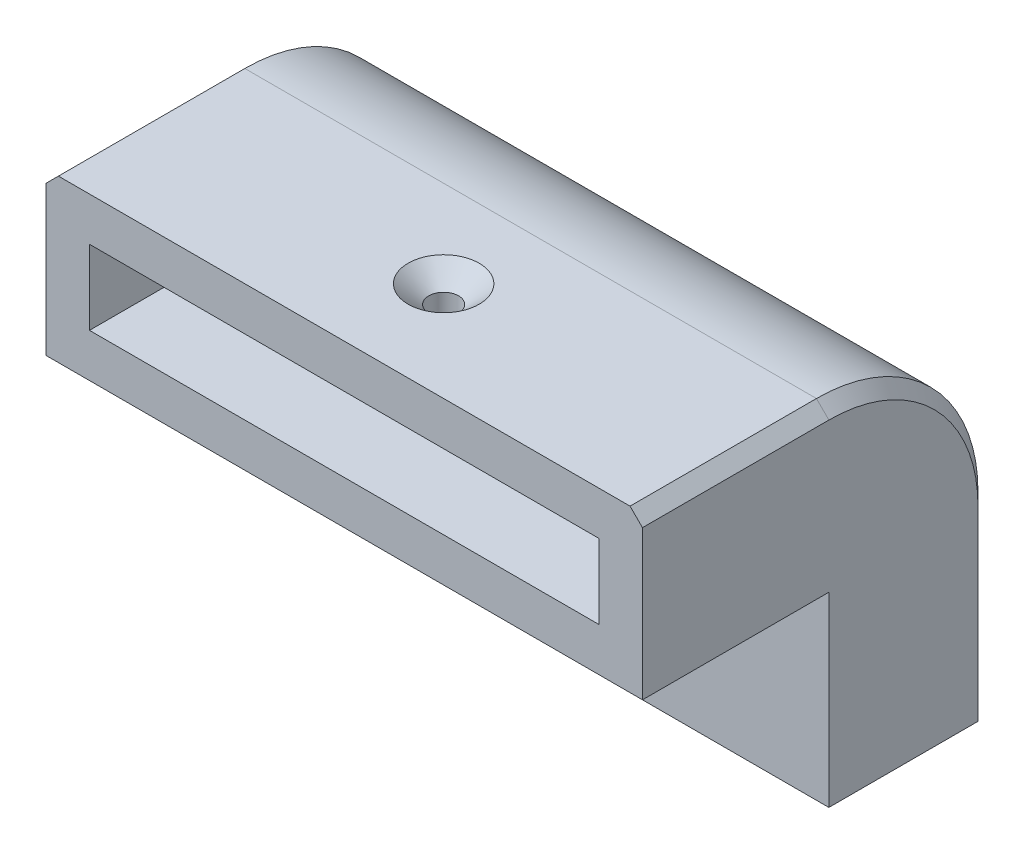
from build123d import *
from OCP.BRepFilletAPI import BRepFilletAPI_MakeChamfer

# Parameters (mm, degrees)
SKETCH1_W           = 60.96
SKETCH1_H           = 16.51
SKETCH1_W_2         = 50.8
SKETCH1_H_2         = 6.35
BOSS_EXTRUDE1_DEPTH = 19.05
BOSS_EXTRUDE2_DEPTH = 60.96
SKETCH6_W           = 50.8
SKETCH6_H           = 6.35
CUT_EXTRUDE1_DEPTH  = 19.05
SKETCH7_R           = 1.524
CUT_EXTRUDE2_DEPTH  = 59.805251466
SKETCH8_R           = 1.524
CUT_EXTRUDE3_DEPTH  = 55.213531752
CHAMFER1_SIZE       = 2.1082
CHAMFER1_SIZE2      = 1.832630301
SKETCH9_W           = 52.07
SKETCH9_H           = 7.62
CUT_EXTRUDE4_DEPTH  = 19.05
SKETCH10_W          = 52.07
SKETCH10_H          = 7.62
CUT_EXTRUDE5_DEPTH  = 19.05
CHAMFER2_SIZE       = 1.27


with BuildPart() as part:
    # Sketch1 → Boss-Extrude1 (new body)
    with BuildSketch(Plane(origin=(0, 0, 0), x_dir=(1, 0, 0), z_dir=(0, 1, 0))):
        Rectangle(SKETCH1_W, SKETCH1_H)
        Rectangle(SKETCH1_W_2, SKETCH1_H_2, mode=Mode.SUBTRACT)
    extrude(amount=BOSS_EXTRUDE1_DEPTH)

    # Sketch5 → Boss-Extrude2 (add)
    with BuildSketch(Plane(origin=(30.48, 0, 0), x_dir=(0, 0, -1), z_dir=(1, 0, 0))):
        with BuildLine():
            Line((-8.255, 35.56), (-27.305, 35.56))
            Line((-27.305, 35.56), (-27.305, 19.05))
            Line((-27.305, 19.05), (-8.255, 19.05))
            Line((-8.255, 19.05), (8.255, 19.05))
            ThreePointArc((8.255, 19.05), (3.419332957, 30.724332957), (-8.255, 35.56))
        make_face()
    extrude(amount=-BOSS_EXTRUDE2_DEPTH)

    # Sketch6 → Cut-Extrude1 (cut)
    with BuildSketch(Plane.XY.offset(27.305)):
        with Locations((0, 27.305)):
            Rectangle(SKETCH6_W, SKETCH6_H)
    extrude(amount=-CUT_EXTRUDE1_DEPTH, mode=Mode.SUBTRACT)

    # Sketch7 → Cut-Extrude2 (cut, through all)
    with BuildSketch(Plane(origin=(0, 0, -8.255), x_dir=(-1, 0, 0), z_dir=(0, 0, -1))):
        with Locations((0, 10.16)):
            Circle(SKETCH7_R)
    extrude(amount=-CUT_EXTRUDE2_DEPTH, mode=Mode.SUBTRACT)

    # Sketch8 → Cut-Extrude3 (cut, through all)
    with BuildSketch(Plane(origin=(0, 35.56, 0), x_dir=(1, 0, 0), z_dir=(0, 1, 0))):
        with Locations(Location((0, -17.145, 0), (0, 0, 270))):
            Circle(SKETCH8_R)
    extrude(amount=-CUT_EXTRUDE3_DEPTH, mode=Mode.SUBTRACT)

    # Chamfer1: one chamfer whose edges measure the first distance from different faces: ONE call of the kernel's chamfer builder (chamfer() names one face for all edges)
    chamfer1_edges_1 = [part.edges().sort_by_distance(p)[0] for p in [
        (1.524, 10.16, 8.255),
    ]]
    chamfer1_side_1 = [part.faces().sort_by_distance(p)[0] for p in [
        (1.524, 10.16, 5.715),
    ]]
    chamfer1_edges_2 = [part.edges().sort_by_distance(p)[0] for p in [
        (0, 35.56, 15.621),
    ]]
    chamfer1_side_2 = [part.faces().sort_by_distance(p)[0] for p in [
        (0, 35.56, 8.893672381),
    ]]
    chamfer1 = BRepFilletAPI_MakeChamfer(part.part.solid().wrapped)
    for e in chamfer1_edges_1:
        chamfer1.Add(CHAMFER1_SIZE, CHAMFER1_SIZE2, e.wrapped, chamfer1_side_1[0].wrapped)  # the first distance lies on this face
    for e in chamfer1_edges_2:
        chamfer1.Add(CHAMFER1_SIZE, CHAMFER1_SIZE2, e.wrapped, chamfer1_side_2[0].wrapped)  # the first distance lies on this face
    add(Compound.cast(chamfer1.Shape()), mode=Mode.REPLACE)

    # Sketch9 → Cut-Extrude4 (cut)
    with BuildSketch(Plane.XY.offset(27.305)):
        with Locations((0, 27.305)):
            Rectangle(SKETCH9_W, SKETCH9_H)
    extrude(amount=-CUT_EXTRUDE4_DEPTH, mode=Mode.SUBTRACT)

    # Sketch10 → Cut-Extrude5 (cut)
    with BuildSketch(Plane.XZ):
        Rectangle(SKETCH10_W, SKETCH10_H)
    extrude(amount=-CUT_EXTRUDE5_DEPTH, mode=Mode.SUBTRACT)

    # Chamfer2
    chamfer2_edges = [part.edges().sort_by_distance(p)[0] for p in [
        (30.48, 30.724332957, -3.419332957),
        (30.48, 35.56, 17.78),
        (-30.48, 30.724332957, -3.419332957),
        (-30.48, 35.56, 17.78),
        (-30.48, 9.525, -8.255),
        (30.48, 9.525, -8.255),
    ]]
    chamfer(chamfer2_edges, length=CHAMFER2_SIZE)


solid = part.part
